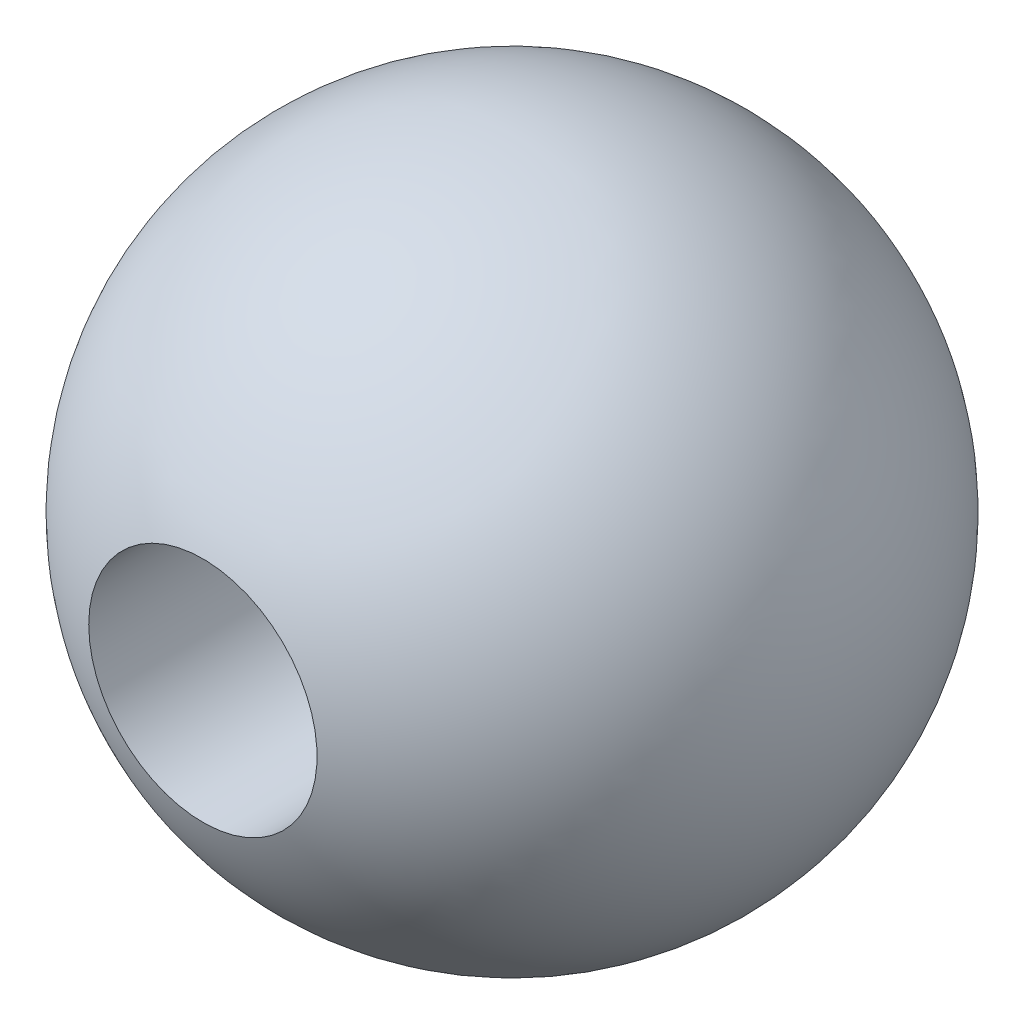
from build123d import *

# Parameters (mm, degrees)
CUT_EXTRUDE_2_DEPTH      = 5
CUT_EXTRUDE_2_DEPTH_BACK = 5
SKETCH_2_R               = 0.75


with BuildPart() as part:
    # 草图1 → 旋转2 (revolve)
    with BuildSketch(Plane.XY):
        with BuildLine():
            Line((0, 2.165), (0, -2.165))
            ThreePointArc((0, -2.165), (-2.165, 0), (0, 2.165))
        make_face()
    revolve(axis=Axis((0, 2.165, 0), (0, -1, 0)))

    # 草图2 → 切除-拉伸2 (cut, two sides: drawn at the far end of the back side and taken through both)
    with BuildSketch(Plane.XY.offset(-CUT_EXTRUDE_2_DEPTH_BACK)):
        Circle(SKETCH_2_R)
    extrude(amount=CUT_EXTRUDE_2_DEPTH + CUT_EXTRUDE_2_DEPTH_BACK, mode=Mode.SUBTRACT)


solid = part.part
